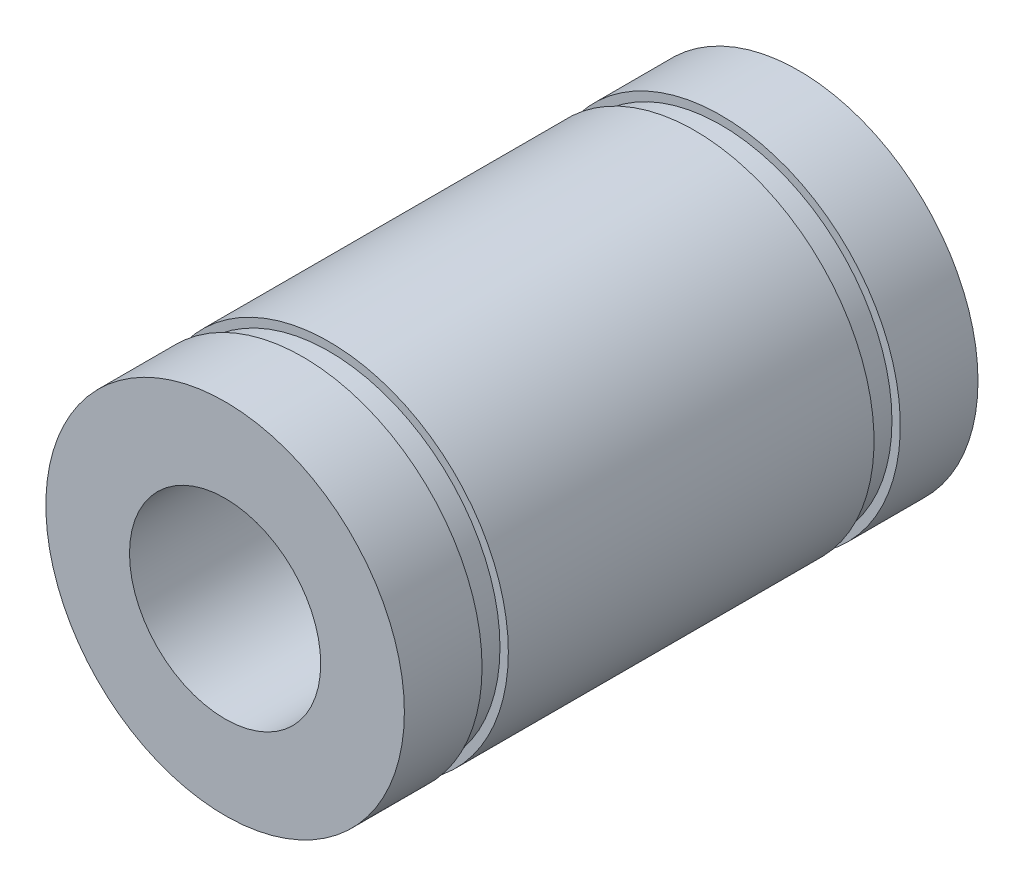
from build123d import *

# Parameters (mm, degrees)
SKETCH1_R           = 7.5
BOSS_EXTRUDE1_DEPTH = 12
SKETCH2_R           = 4
CUT_EXTRUDE1_DEPTH  = 27.239283527
CUT_EXTRUDE2_START  = -3.25
SKETCH3_OUTSIDE_W   = 23.406
SKETCH3_OUTSIDE_H   = 23.406
SKETCH3_OUTSIDE_R   = 7.15
CUT_EXTRUDE2_DEPTH  = 1.1


with BuildPart() as part:
    # Sketch1 → Boss-Extrude1 (new, symmetric)
    with BuildSketch(Plane.XY):
        Circle(SKETCH1_R)
    extrude(amount=BOSS_EXTRUDE1_DEPTH, both=True)

    # Sketch2 → Cut-Extrude1 (cut, through all)
    with BuildSketch(Plane.XY.offset(12)):
        Circle(SKETCH2_R)
    extrude(amount=-CUT_EXTRUDE1_DEPTH, mode=Mode.SUBTRACT)

    # Sketch3 outside → Cut-Extrude2 (cut)
    with BuildSketch(Plane.XY.offset(12).offset(CUT_EXTRUDE2_START)):
        Rectangle(SKETCH3_OUTSIDE_W, SKETCH3_OUTSIDE_H)
        Circle(SKETCH3_OUTSIDE_R, mode=Mode.SUBTRACT)
    cut_extrude2 = extrude(amount=-CUT_EXTRUDE2_DEPTH, mode=Mode.SUBTRACT)

    # Mirror1: Cut-Extrude2 across plane
    add(cut_extrude2.mirror(Plane.XY), mode=Mode.SUBTRACT)


solid = part.part
